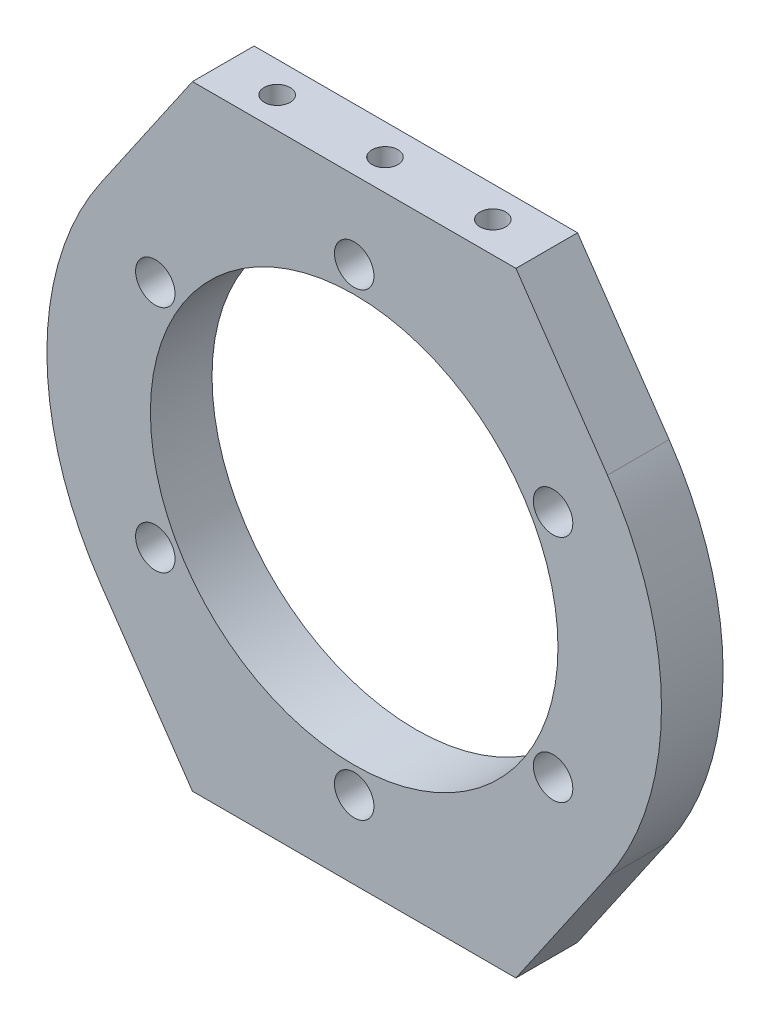
from build123d import *

# Parameters (mm, degrees)
BOSS_EXTRUDE1_DEPTH       = 9.525
F_6_0MM_DOWEL_HOLE1_D     = 6.1
SKETCH4_R                 = 31.5
CUT_EXTRUDE1_DEPTH        = 68.847075287
F_4_0MM_DOWEL_HOLE1_D     = 4
F_4_0MM_DOWEL_HOLE1_DEPTH = 3.2
F_4_0MM_DOWEL_HOLE1_TIP   = 1.201721238
F_4_0MM_DOWEL_HOLE2_D     = 4
F_4_0MM_DOWEL_HOLE2_DEPTH = 3.2
F_4_0MM_DOWEL_HOLE2_TIP   = 1.201721238


with BuildPart() as part:
    # Sketch1 → Boss-Extrude1 (new body)
    with BuildSketch(Plane.XY):
        with BuildLine():
            Line((-25, 47.5), (25, 47.5))
            Line((25, 47.5), (39.154013015, 26.892624729))
            ThreePointArc((39.154013015, 26.892624729), (47.5, 0), (39.154013015, -26.892624729))
            Line((39.154013015, -26.892624729), (25, -47.5))
            Line((25, -47.5), (-25, -47.5))
            Line((-25, -47.5), (-39.154013015, -26.892624729))
            ThreePointArc((-39.154013015, -26.892624729), (-47.5, 0), (-39.154013015, 26.892624729))
            Line((-39.154013015, 26.892624729), (-25, 47.5))
        make_face()
    extrude(amount=-BOSS_EXTRUDE1_DEPTH)

    # Ø6.0mm Dowel Hole1 (through all)
    with Locations(Plane.XY):
        with Locations((-30.743901834, 17.75), (0, 35.5), (30.743901834, 17.75), (30.743901834, -17.75), (0, -35.5), (-30.743901834, -17.75)):
            Hole(F_6_0MM_DOWEL_HOLE1_D / 2)

    # Sketch4 → Cut-Extrude1 (cut, through all)
    with BuildSketch(Plane(origin=(0, 0, -9.525), x_dir=(-1, 0, 0), z_dir=(0, 0, -1))):
        Circle(SKETCH4_R)
    extrude(amount=-CUT_EXTRUDE1_DEPTH, mode=Mode.SUBTRACT)

    # Ø4.0mm Dowel Hole1
    with Locations(Plane(origin=(0, 47.5, 0), x_dir=(1, 0, 0), z_dir=(0, 1, 0))):
        with Locations((-16.67, 4.7625), (0, 4.7625), (16.67, 4.7625)):
            Hole(F_4_0MM_DOWEL_HOLE1_D / 2, depth=F_4_0MM_DOWEL_HOLE1_DEPTH)
            with Locations((0, 0, -(F_4_0MM_DOWEL_HOLE1_DEPTH + F_4_0MM_DOWEL_HOLE1_TIP / 2))):  # 118° drill point
                Cone(0, F_4_0MM_DOWEL_HOLE1_D / 2, F_4_0MM_DOWEL_HOLE1_TIP, mode=Mode.SUBTRACT)

    # Ø4.0mm Dowel Hole2
    with Locations(Plane.XZ.offset(47.5)):
        with Locations((0, -4.7625), (-16.67, -4.7625), (16.67, -4.7625)):
            Hole(F_4_0MM_DOWEL_HOLE2_D / 2, depth=F_4_0MM_DOWEL_HOLE2_DEPTH)
            with Locations((0, 0, -(F_4_0MM_DOWEL_HOLE2_DEPTH + F_4_0MM_DOWEL_HOLE2_TIP / 2))):  # 118° drill point
                Cone(0, F_4_0MM_DOWEL_HOLE2_D / 2, F_4_0MM_DOWEL_HOLE2_TIP, mode=Mode.SUBTRACT)


solid = part.part
